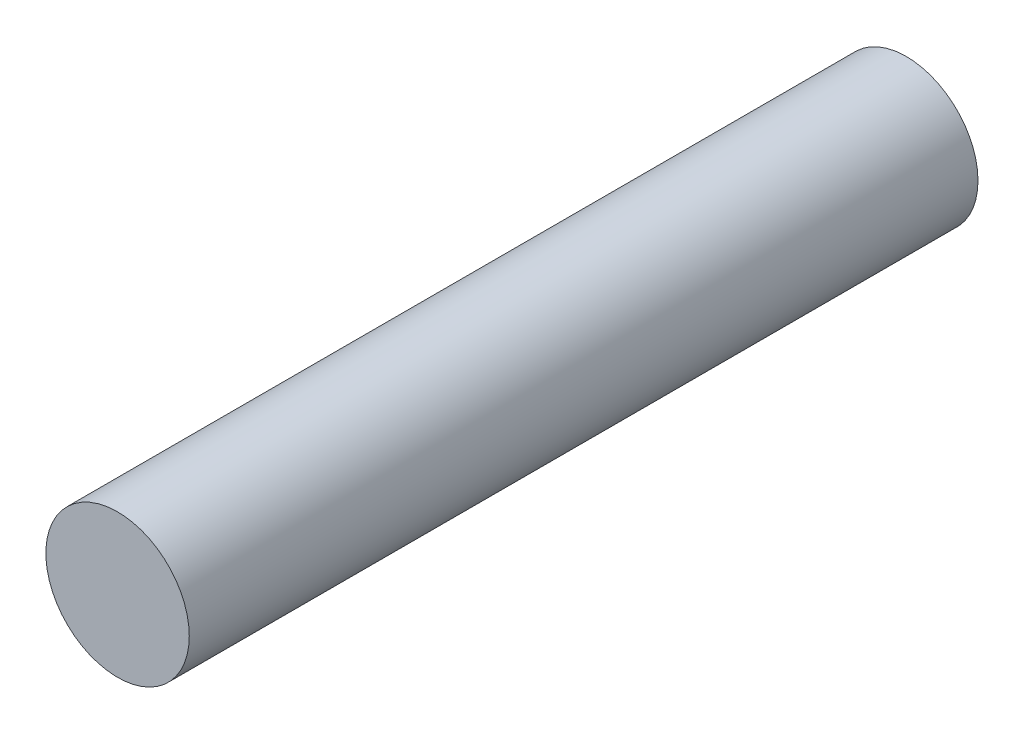
from build123d import *

# Parameters (mm, degrees)
SKETCH_1_R        = 2
EXTRUDE_302_DEPTH = 22


with BuildPart() as part:
    # Эскиз1 → Extrude 302 (new body)
    with BuildSketch(Plane.XY):
        Circle(SKETCH_1_R)
    extrude(amount=EXTRUDE_302_DEPTH)


solid = part.part
